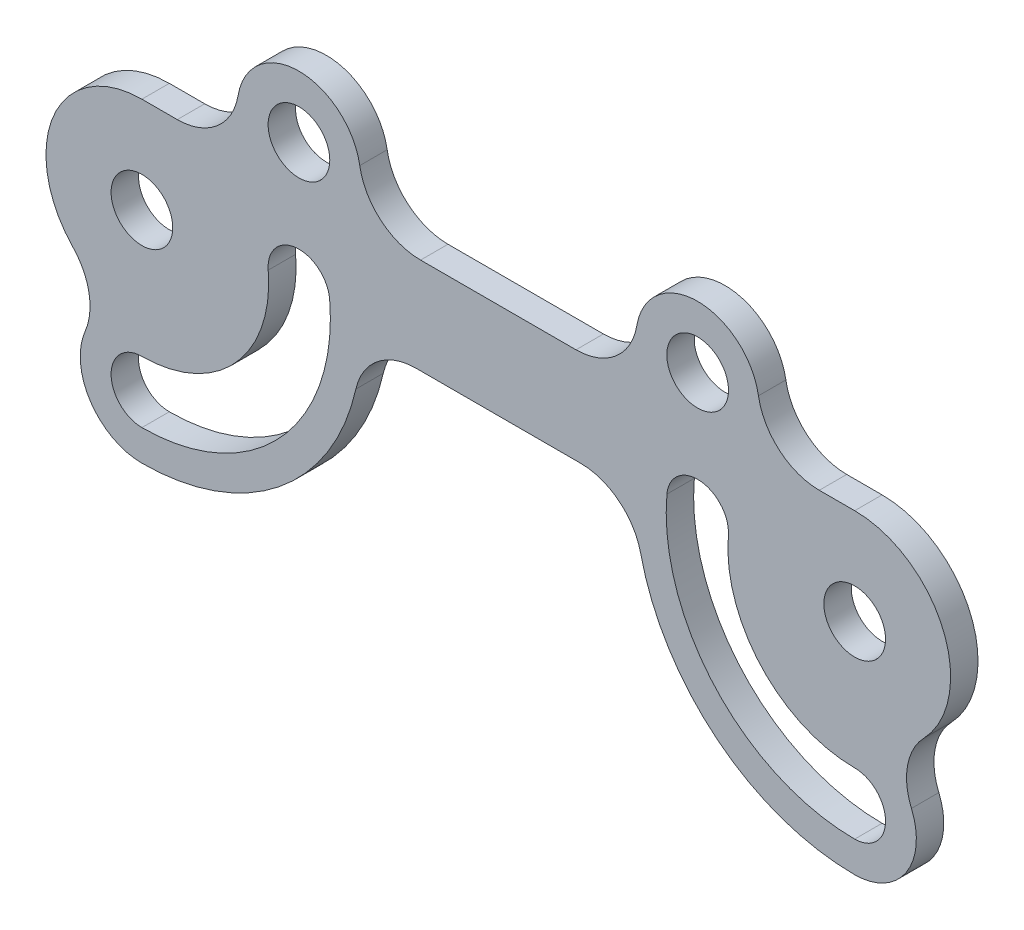
from build123d import *

# Parameters (mm, degrees)
SKETCH1_R           = 1.7859375
BOSS_EXTRUDE2_DEPTH = 1.5875
FILLET2_R           = 3.571875


with BuildPart() as part:
    # Sketch1 → Boss-Extrude2 (new body)
    with BuildSketch(Plane.XY):
        with BuildLine():
            ThreePointArc((41.275, -12.7), (44.846875, -9.128125), (41.275, -5.55625))
            ThreePointArc((41.275, -5.55625), (46.83125, 0), (41.275, 5.55625))
            Line((41.275, 5.55625), (34.84230106, 5.55625))
            ThreePointArc((34.84230106, 5.55625), (32.181610271, 11.511193514), (29.520919483, 5.55625))
            Line((29.520919483, 5.55625), (11.754080517, 5.55625))
            ThreePointArc((11.754080517, 5.55625), (9.093389729, 11.511193514), (6.43269894, 5.55625))
            Line((6.43269894, 5.55625), (0, 5.55625))
            ThreePointArc((0, 5.55625), (-5.55625, 0), (0, -5.55625))
            ThreePointArc((0, -5.55625), (-3.571875, -9.128125), (0, -12.7))
            ThreePointArc((0, -12.7), (8.980256121, -8.980256121), (12.7, 0))
            Line((12.7, 0), (28.575, 0))
            ThreePointArc((28.575, 0), (32.294743879, -8.980256121), (41.275, -12.7))
        make_face()
        with BuildLine():
            ThreePointArc((0, -10.9140625), (-1.7859375, -9.128125), (0, -7.3421875))
            ThreePointArc((0, -7.3421875), (5.413228446, -4.960309977), (7.31424826, 0.639913805))
            ThreePointArc((7.31424826, 0.639913805), (8.937735019, 2.574709983), (10.872531197, 0.951223224))
            ThreePointArc((10.872531197, 0.951223224), (8.046690934, -7.37343375), (0, -10.9140625))
        make_face(mode=Mode.SUBTRACT)
        with BuildLine():
            ThreePointArc((33.96075174, 0.639913805), (35.861771554, -4.960309977), (41.275, -7.3421875))
            ThreePointArc((41.275, -7.3421875), (43.0609375, -9.128125), (41.275, -10.9140625))
            ThreePointArc((41.275, -10.9140625), (33.228309066, -7.37343375), (30.402468803, 0.951223224))
            ThreePointArc((30.402468803, 0.951223224), (32.337264981, 2.574709983), (33.96075174, 0.639913805))
        make_face(mode=Mode.SUBTRACT)
        Circle(SKETCH1_R, mode=Mode.SUBTRACT)
        with Locations((9.093389729, 7.939318514)):
            Circle(SKETCH1_R, mode=Mode.SUBTRACT)
        with Locations((41.275, 0)):
            Circle(SKETCH1_R, mode=Mode.SUBTRACT)
        with Locations((32.181610271, 7.939318514)):
            Circle(SKETCH1_R, mode=Mode.SUBTRACT)
    extrude(amount=BOSS_EXTRUDE2_DEPTH)

    # Fillet2
    fillet2_edges = [part.edges().sort_by_distance(p)[0] for p in [
        (6.43269894, 5.55625, 0.79375),
        (11.754080517, 5.55625, 0.79375),
        (29.520919483, 5.55625, 0.79375),
        (34.84230106, 5.55625, 0.79375),
        (41.275, -5.55625, 0.79375),
        (28.575, 0, 0.79375),
        (12.7, 0, 0.79375),
        (0, -5.55625, 0.79375),
    ]]
    fillet(fillet2_edges, radius=FILLET2_R)


solid = part.part
